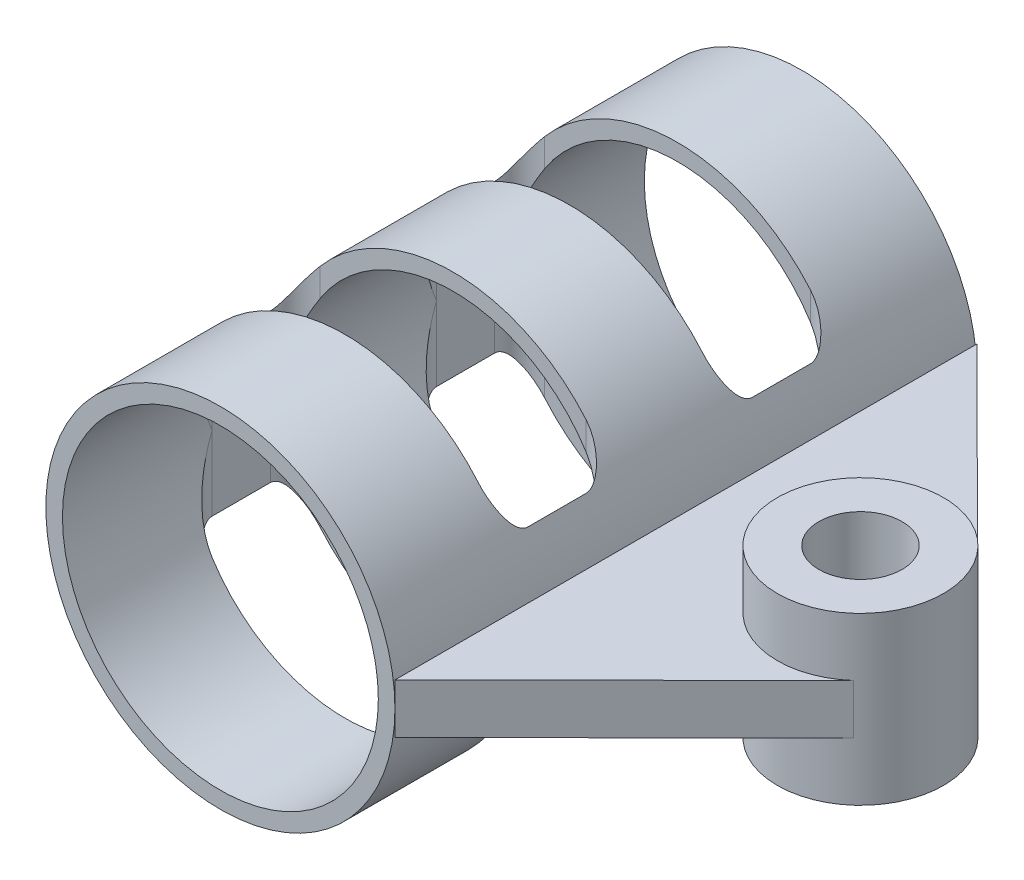
from build123d import *

# Parameters (mm, degrees)
SKETCH1_R           = 21
SKETCH1_R_2         = 19
BOSS_EXTRUDE1_DEPTH = 70
SKETCH2_R           = 10
BOSS_EXTRUDE2_DEPTH = 10
SKETCH3_R           = 5
CUT_EXTRUDE1_DEPTH  = 20
BOSS_EXTRUDE3_DEPTH = 3
CUT_EXTRUDE2_DEPTH  = 25


with BuildPart() as part:
    # Sketch1 → Boss-Extrude1 (new body)
    with BuildSketch(Plane.XY):
        Circle(SKETCH1_R)
        Circle(SKETCH1_R_2, mode=Mode.SUBTRACT)
    extrude(amount=BOSS_EXTRUDE1_DEPTH)

    # Sketch5 → Cut-Extrude2 (cut, symmetric)
    with BuildSketch(Plane(origin=(0, 0, 0), x_dir=(1, 0, 0), z_dir=(0, 1, 0))):
        with BuildLine():
            Line((-16, -15), (16, -15))
            ThreePointArc((16, -15), (18.121320344, -15.878679656), (19, -18))
            Line((19, -18), (19, -25))
            ThreePointArc((19, -25), (18.121320344, -27.121320344), (16, -28))
            Line((16, -28), (-16, -28))
            ThreePointArc((-16, -28), (-18.121320344, -27.121320344), (-19, -25))
            Line((-19, -25), (-19, -18))
            ThreePointArc((-19, -18), (-18.121320344, -15.878679656), (-16, -15))
        make_face()
        with BuildLine():
            Line((19, -52), (19, -45))
            ThreePointArc((19, -45), (18.121320344, -42.878679656), (16, -42))
            Line((16, -42), (-16, -42))
            ThreePointArc((-16, -42), (-18.121320344, -42.878679656), (-19, -45))
            Line((-19, -45), (-19, -52))
            ThreePointArc((-19, -52), (-18.121320344, -54.121320344), (-16, -55))
            Line((-16, -55), (16, -55))
            ThreePointArc((16, -55), (18.121320344, -54.121320344), (19, -52))
        make_face()
    extrude(amount=CUT_EXTRUDE2_DEPTH, both=True, mode=Mode.SUBTRACT)


with BuildPart() as body_2:
    # Sketch2 → Boss-Extrude2 (new, symmetric)
    with BuildSketch(Plane(origin=(0, 0, 0), x_dir=(1, 0, 0), z_dir=(0, 1, 0))):
        with Locations(Location((42, -35, 0), (0, 0, 270))):
            Circle(SKETCH2_R)
    extrude(amount=BOSS_EXTRUDE2_DEPTH, both=True)

    # Sketch3 → Cut-Extrude1 (cut)
    with BuildSketch(Plane(origin=(0, 10, 0), x_dir=(1, 0, 0), z_dir=(0, 1, 0))):
        with Locations(Location((42, -35, 0), (0, 0, 270))):
            Circle(SKETCH3_R)
    extrude(amount=-CUT_EXTRUDE1_DEPTH, mode=Mode.SUBTRACT)

    # Sketch4 → Boss-Extrude3 (add, symmetric)
    with BuildSketch(Plane(origin=(0, 0, 0), x_dir=(1, 0, 0), z_dir=(0, 1, 0))):
        with BuildLine():
            Line((21, 0), (48.634777914, -27.518040228))
            ThreePointArc((48.634777914, -27.518040228), (32, -35), (48.634777914, -42.481959772))
            Line((48.634777914, -42.481959772), (21, -70))
            Line((21, -70), (21, 0))
        make_face()
    extrude(amount=BOSS_EXTRUDE3_DEPTH, both=True)


solid = Compound([part.part, body_2.part])
